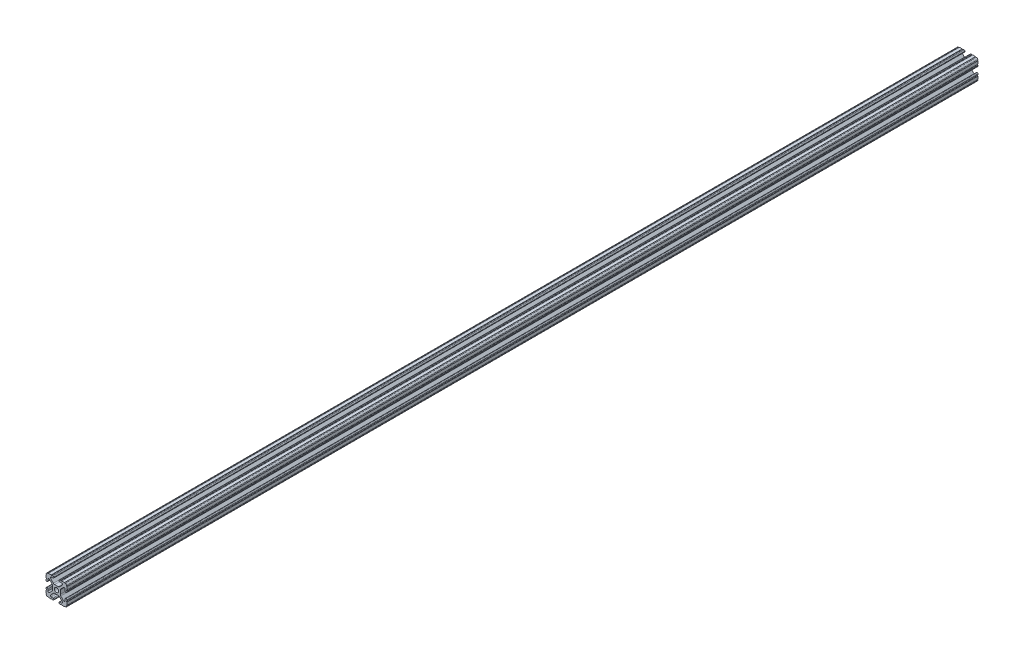
from build123d import *

# Parameters (mm, degrees)
BOSS_EXTRUDE1_START     = -553.701162
BOSS_EXTRUDE1_DEPTH     = 1107.402324
CUT_EXTRUDE1_DEPTH      = 554.992379731
CUT_EXTRUDE1_DEPTH_BACK = 554.992379731
SKETCH5_R               = 0.55245


with BuildPart() as part:
    # Sketch4 → Boss-Extrude1 (new body)
    with BuildSketch(Plane.XY.offset(BOSS_EXTRUDE1_START)):
        with BuildLine():
            Line((4.190365, -12.7), (10.11729625, -12.7))
            ThreePointArc((10.11729625, -12.7), (11.943543585, -11.943543585), (12.7, -10.11729625))
            Line((12.7, -10.11729625), (12.7, -4.190365))
            ThreePointArc((12.7, -4.190365), (12.42492494, -3.52627506), (11.760835, -3.2512))
            Line((11.760835, -3.2512), (11.429365, -3.2512))
            ThreePointArc((11.429365, -3.2512), (10.76527506, -3.52627506), (10.4902, -4.190365))
            Line((10.4902, -4.190365), (10.4902, -6.348478019))
            ThreePointArc((10.4902, -6.348478019), (9.830707141, -7.335478831), (8.666460301, -7.103895736))
            Line((8.666460301, -7.103895736), (5.299899128, -3.737334563))
            ThreePointArc((5.299899128, -3.737334563), (4.817571085, -3.015479634), (4.6482, -2.16399369))
            Line((4.6482, -2.16399369), (4.6482, 0))
            Line((4.6482, 0), (2.6035, 0))
            ThreePointArc((2.6035, 0), (1.840952505, -1.840952505), (0, -2.6035))
            Line((0, -2.6035), (0, -4.6482))
            Line((0, -4.6482), (2.16399369, -4.6482))
            ThreePointArc((2.16399369, -4.6482), (3.015479634, -4.817571085), (3.737334563, -5.299899128))
            Line((3.737334563, -5.299899128), (7.103895736, -8.666460301))
            ThreePointArc((7.103895736, -8.666460301), (7.335478831, -9.830707141), (6.348478019, -10.4902))
            Line((6.348478019, -10.4902), (4.190365, -10.4902))
            ThreePointArc((4.190365, -10.4902), (3.52627506, -10.76527506), (3.2512, -11.429365))
            Line((3.2512, -11.429365), (3.2512, -11.760835))
            ThreePointArc((3.2512, -11.760835), (3.52627506, -12.42492494), (4.190365, -12.7))
        make_face()
    extrude(amount=BOSS_EXTRUDE1_DEPTH)

    # Sketch5 → Cut-Extrude1 (cut, two sides: drawn at the far end of the back side and taken through both)
    with BuildSketch(Plane.XY.offset(-CUT_EXTRUDE1_DEPTH_BACK)):
        with Locations((10.356153152, -12.7)):
            Circle(SKETCH5_R)
        with Locations((5.796028019, -12.7)):
            Circle(SKETCH5_R)
        with Locations((12.7, -10.356153152)):
            Circle(SKETCH5_R)
        with Locations((12.7, -5.796028019)):
            Circle(SKETCH5_R)
    extrude(amount=CUT_EXTRUDE1_DEPTH + CUT_EXTRUDE1_DEPTH_BACK, mode=Mode.SUBTRACT)

    # Mirror1: part across plane


with BuildPart() as part_1:
    add(part.part)
    add(part.part.mirror(Plane(origin=(0, 0, 0), x_dir=(0, 0, 1), z_dir=(1, 0, 0))))

    # Mirror2: part across plane


with BuildPart() as part_2:
    add(part_1.part)
    add(part_1.part.mirror(Plane.ZX))


solid = part_2.part
